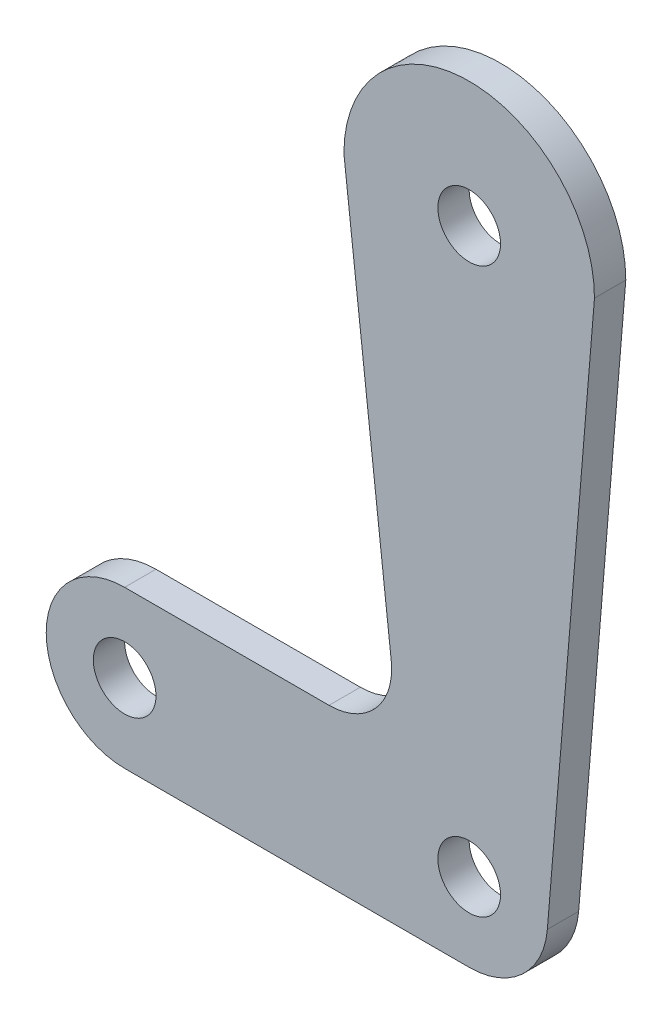
from build123d import *

# Parameters (mm, degrees)
SKETCH1_R           = 3.175
BOSS_EXTRUDE1_DEPTH = 3.175


with BuildPart() as part:
    # Sketch1 → Boss-Extrude1 (new body)
    with BuildSketch(Plane.XY):
        with BuildLine():
            Line((20.716035226, 7.9502), (0, 7.9502))
            ThreePointArc((0, 7.9502), (-7.9502, 0), (0, -7.9502))
            Line((0, -7.9502), (34.925, -7.9502))
            ThreePointArc((34.925, -7.9502), (40.310178716, -5.848549413), (42.84819283, -0.654748362))
            Line((42.84819283, -0.654748362), (47.452723337, 55.065258294))
            Line((47.452723337, 55.065258294), (47.625, 57.15))
            ThreePointArc((47.625, 57.15), (34.925, 69.85), (22.225, 57.15))
            Line((22.225, 57.15), (22.550500177, 54.29312161))
            Line((22.550500177, 54.29312161), (27.02521651, 15.019040407))
            ThreePointArc((27.02521651, 15.019040407), (25.453499558, 10.071851421), (20.716035226, 7.9502))
        make_face()
        Circle(SKETCH1_R, mode=Mode.SUBTRACT)
        with Locations((34.925, 0)):
            Circle(SKETCH1_R, mode=Mode.SUBTRACT)
        with Locations((34.925, 57.15)):
            Circle(SKETCH1_R, mode=Mode.SUBTRACT)
    extrude(amount=BOSS_EXTRUDE1_DEPTH)


solid = part.part
